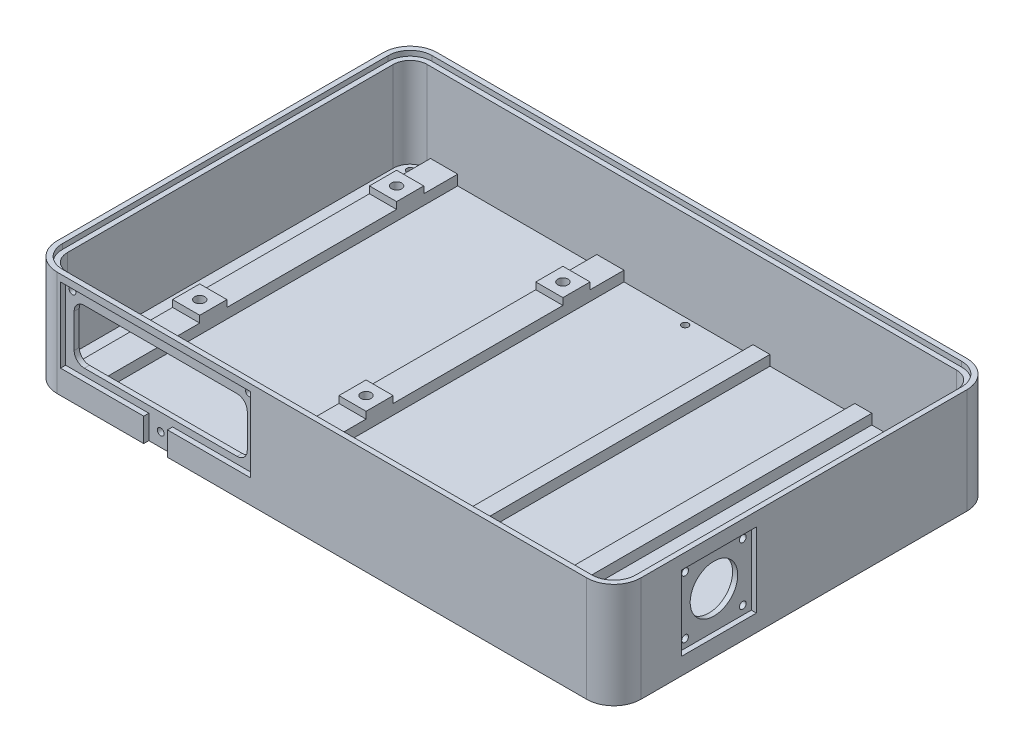
from build123d import *

# Parameters (mm, degrees)
EXTRUDE_1_DEPTH             = 28
SKETCH_3_W                  = 8
SKETCH_3_H                  = 106
EXTRUDE_2_DEPTH             = 3
EXTRUDE_2_2_DEPTH           = 3
EXTRUDE_START               = -3
EXTRUDE_3_DEPTH             = 3
HOLE_WIZARD_M51_D           = 2
HOLE_WIZARD_M51_CBORE_D     = 3
HOLE_WIZARD_M51_CBORE_DEPTH = 1
SKETCH_17_W                 = 56
SKETCH_17_H                 = 22
SKETCH_17_W_2               = 7
SKETCH_17_H_2               = 7
CUT_EXTRUDE_2_DEPTH         = 1.5
CUT_EXTRUDE_3_REACH         = 208.345
SKETCH_18_W                 = 51
SKETCH_18_H                 = 16
SKETCH_19_W                 = 8
SKETCH_19_H                 = 8
EXTRUDE_4_DEPTH             = 2
HOLE_WIZARD_3_0_3_1_D       = 3
HOLE_WIZARD_3_0_3_1_DEPTH   = 5
HOLE_WIZARD_3_0_3_1_TIP     = 0.901290929
HOLE_WIZARD_2_0_2_1_D       = 2
HOLE_WIZARD_2_0_2_1_DEPTH   = 5
HOLE_WIZARD_2_0_2_1_TIP     = 0.600860619
CUT_EXTRUDE_4_DEPTH         = 1.5
FILLET_1_R                  = 3
SKETCH_28_W                 = 5
SKETCH_28_H                 = 106
EXTRUDE_5_DEPTH             = 3
SKETCH_29_W                 = 22
SKETCH_29_H                 = 22
CUT_EXTRUDE_5_DEPTH         = 1.5
SKETCH_30_R                 = 7
CUT_EXTRUDE_6_DEPTH         = 1.5
HOLE_WIZARD_2_0_2_2_D       = 2
HOLE_WIZARD_2_0_2_2_DEPTH   = 1.5
HOLE_WIZARD_2_0_2_2_TIP     = 0.600860619


with BuildPart() as part:
    # Эскиз1 → Бобышка-Вытянуть1 (new body)
    with BuildSketch(Plane(origin=(0, 0, 0), x_dir=(1, 0, 0), z_dir=(0, 1, 0))):
        with BuildLine():
            Line((8, 0), (164, 0))
            ThreePointArc((164, 0), (169.656854249, 2.343145751), (172, 8))
            Line((172, 8), (172, 104))
            ThreePointArc((172, 104), (169.656854249, 109.656854249), (164, 112))
            Line((164, 112), (8, 112))
            ThreePointArc((8, 112), (2.343145751, 109.656854249), (0, 104))
            Line((0, 104), (0, 8))
            ThreePointArc((0, 8), (2.343145751, 2.343145751), (8, 0))
        make_face()
        with BuildLine():
            Line((8, 109), (164, 109))
            ThreePointArc((164, 109), (167.535533906, 107.535533906), (169, 104))
            Line((169, 104), (169, 8))
            ThreePointArc((169, 8), (167.535533906, 4.464466094), (164, 3))
            Line((164, 3), (8, 3))
            ThreePointArc((8, 3), (4.464466094, 4.464466094), (3, 8))
            Line((3, 8), (3, 104))
            ThreePointArc((3, 104), (4.464466094, 107.535533906), (8, 109))
        make_face(mode=Mode.SUBTRACT)
    extrude(amount=EXTRUDE_1_DEPTH)



with BuildPart() as body_2:
    # Эскиз3 → Бобышка-Вытянуть2 (new body)
    with BuildSketch(Plane(origin=(0, 0, 0), x_dir=(1, 0, 0), z_dir=(0, 1, 0))):
        with Locations((13, 56)):
            Rectangle(SKETCH_3_W, SKETCH_3_H)
    extrude(amount=EXTRUDE_2_DEPTH)


with BuildPart() as body_3:
    # Эскиз3 → Extrude 2 2 (new body)
    with BuildSketch(Plane(origin=(0, 0, 0), x_dir=(1, 0, 0), z_dir=(0, 1, 0))):
        with Locations((62, 56)):
            Rectangle(SKETCH_3_W, SKETCH_3_H)
    extrude(amount=EXTRUDE_2_2_DEPTH)


with BuildPart() as part_1:
    add(part.part)

    add(body_2.part)  # Бобышка-Вытянуть3 merges body 2

    add(body_3.part)  # Бобышка-Вытянуть3 merges body 3
    # Эскиз6 → Бобышка-Вытянуть3 (add)
    with BuildSketch(Plane(origin=(0, 0, 0), x_dir=(1, 0, 0), z_dir=(0, 1, 0)).offset(EXTRUDE_START)):
        with BuildLine():
            Line((0, 8), (0, 104))
            ThreePointArc((0, 104), (2.343145751, 109.656854249), (8, 112))
            Line((8, 112), (164, 112))
            ThreePointArc((164, 112), (169.656854249, 109.656854249), (172, 104))
            Line((172, 104), (172, 8))
            ThreePointArc((172, 8), (169.656854249, 2.343145751), (164, 0))
            Line((164, 0), (8, 0))
            ThreePointArc((8, 0), (2.343145751, 2.343145751), (0, 8))
        make_face()
    extrude(amount=EXTRUDE_3_DEPTH)

    # Цековка для  болта с шестигранной головкой M51 (through all)
    with Locations(Plane(origin=(0, -3, 0), x_dir=(-1, 0, 0), z_dir=(0, -1, 0))):
        with Locations((-6, 6), (-6, 106), (-166, 106), (-166, 6), (-86, 5), (-86, 107)):
            CounterBoreHole(HOLE_WIZARD_M51_D / 2, HOLE_WIZARD_M51_CBORE_D / 2, HOLE_WIZARD_M51_CBORE_DEPTH)

    # Эскиз17 → Вырез-Вытянуть2 (cut)
    with BuildSketch(Plane.XY):
        with Locations((37, 15)):
            Rectangle(SKETCH_17_W, SKETCH_17_H)
        with Locations((37, 0.5)):
            Rectangle(SKETCH_17_W_2, SKETCH_17_H_2)
    extrude(amount=-CUT_EXTRUDE_2_DEPTH, mode=Mode.SUBTRACT)

    # Эскиз18 → Вырез-Вытянуть3 (cut, up to next)
    with BuildSketch(Plane.XY.offset(-1.5), mode=Mode.PRIVATE) as cut_extrude_3_sk1:
        with Locations((37, 14)):
            Rectangle(SKETCH_18_W, SKETCH_18_H)
    cut_extrude_3_tool1 = extrude(cut_extrude_3_sk1.sketch, amount=-CUT_EXTRUDE_3_REACH, mode=Mode.PRIVATE) & part_1.part
    add(cut_extrude_3_tool1.solids().sort_by_distance((37, 14, -1.5))[0], mode=Mode.SUBTRACT)

    # Эскиз19 → Бобышка-Вытянуть4 (add)
    with BuildSketch(Plane(origin=(0, 3, 0), x_dir=(1, 0, 0), z_dir=(0, 1, 0))):
        with Locations((13, 95)):
            Rectangle(SKETCH_19_W, SKETCH_19_H)
        with Locations((62, 95)):
            Rectangle(SKETCH_19_W, SKETCH_19_H)
        with Locations((13, 37)):
            Rectangle(SKETCH_19_W, SKETCH_19_H)
        with Locations((62, 37)):
            Rectangle(SKETCH_19_W, SKETCH_19_H)
    extrude(amount=EXTRUDE_4_DEPTH)

    # Диаметр отверстия Ø3.0 (3)1
    with Locations(Plane(origin=(0, 5, 0), x_dir=(1, 0, 0), z_dir=(0, 1, 0))):
        with Locations((13, 95), (62, 95), (62, 37), (13, 37)):
            Hole(HOLE_WIZARD_3_0_3_1_D / 2, depth=HOLE_WIZARD_3_0_3_1_DEPTH)
            with Locations((0, 0, -(HOLE_WIZARD_3_0_3_1_DEPTH + HOLE_WIZARD_3_0_3_1_TIP / 2))):  # 118° drill point
                Cone(0, HOLE_WIZARD_3_0_3_1_D / 2, HOLE_WIZARD_3_0_3_1_TIP, mode=Mode.SUBTRACT)

    # Диаметр отверстия Ø2.0 (2)1
    with Locations(Plane.XY.offset(-1.5)):
        with Locations((37, 1), (11, 24), (63, 24)):
            Hole(HOLE_WIZARD_2_0_2_1_D / 2, depth=HOLE_WIZARD_2_0_2_1_DEPTH)
            with Locations((0, 0, -(HOLE_WIZARD_2_0_2_1_DEPTH + HOLE_WIZARD_2_0_2_1_TIP / 2))):  # 118° drill point
                Cone(0, HOLE_WIZARD_2_0_2_1_D / 2, HOLE_WIZARD_2_0_2_1_TIP, mode=Mode.SUBTRACT)

    # Эскиз27 → Вырез-Вытянуть4 (cut)
    with BuildSketch(Plane(origin=(0, 28, 0), x_dir=(1, 0, 0), z_dir=(0, 1, 0))):
        with BuildLine():
            Line((170.5, 8), (170.5, 104))
            ThreePointArc((170.5, 104), (168.596194078, 108.596194078), (164, 110.5))
            Line((164, 110.5), (8, 110.5))
            ThreePointArc((8, 110.5), (3.403805922, 108.596194078), (1.5, 104))
            Line((1.5, 104), (1.5, 8))
            ThreePointArc((1.5, 8), (3.403805922, 3.403805922), (8, 1.5))
            Line((8, 1.5), (164, 1.5))
            ThreePointArc((164, 1.5), (168.596194078, 3.403805922), (170.5, 8))
        make_face()
    extrude(amount=-CUT_EXTRUDE_4_DEPTH, mode=Mode.SUBTRACT)

    # Скругление1
    fillet_1_edges = [part_1.edges().sort_by_distance(p)[0] for p in [
        (11.5, 6, -2.25),
        (11.5, 22, -2.25),
        (62.5, 22, -2.25),
        (62.5, 6, -2.25),
    ]]
    fillet(fillet_1_edges, radius=FILLET_1_R)

    # Эскиз28 → Бобышка-Вытянуть5 (add)
    with BuildSketch(Plane(origin=(0, 0, 0), x_dir=(1, 0, 0), z_dir=(0, 1, 0))):
        with Locations((106.5, 56)):
            Rectangle(SKETCH_28_W, SKETCH_28_H)
        with Locations((136.5, 56)):
            Rectangle(SKETCH_28_W, SKETCH_28_H)
    extrude(amount=EXTRUDE_5_DEPTH)

    # Эскиз29 → Вырез-Вытянуть5 (cut)
    with BuildSketch(Plane(origin=(172, 0, 0), x_dir=(0, 0, -1), z_dir=(1, 0, 0))):
        with Locations((31, 13)):
            Rectangle(SKETCH_29_W, SKETCH_29_H)
    extrude(amount=-CUT_EXTRUDE_5_DEPTH, mode=Mode.SUBTRACT)

    # Эскиз30 → Вырез-Вытянуть6 (cut)
    with BuildSketch(Plane(origin=(170.5, 0, 0), x_dir=(0, 0, -1), z_dir=(1, 0, 0))):
        with Locations((31, 13)):
            Circle(SKETCH_30_R)
    extrude(amount=-CUT_EXTRUDE_6_DEPTH, mode=Mode.SUBTRACT)

    # Диаметр отверстия Ø2.0 (2)2
    with Locations(Plane(origin=(170.5, 0, 0), x_dir=(0, 0, -1), z_dir=(1, 0, 0))):
        with Locations((22.5, 21.5), (39.5, 21.5), (39.5, 4.5), (22.5, 4.5)):
            Hole(HOLE_WIZARD_2_0_2_2_D / 2, depth=HOLE_WIZARD_2_0_2_2_DEPTH)
            with Locations((0, 0, -(HOLE_WIZARD_2_0_2_2_DEPTH + HOLE_WIZARD_2_0_2_2_TIP / 2))):  # 118° drill point
                Cone(0, HOLE_WIZARD_2_0_2_2_D / 2, HOLE_WIZARD_2_0_2_2_TIP, mode=Mode.SUBTRACT)


solid = part_1.part
